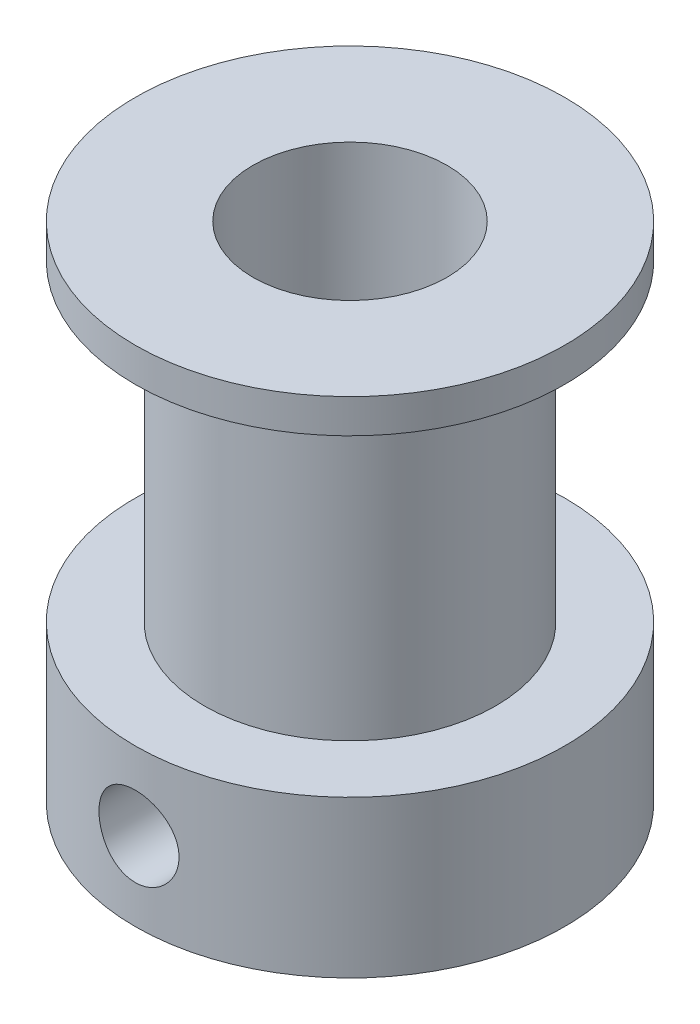
from build123d import *

# Parameters (mm, degrees)
CROQUIS1_R              = 8.85
SALIENTE_EXTRUIR1_DEPTH = 6.45
CROQUIS2_R              = 6
SALIENTE_EXTRUIR2_DEPTH = 12.9
CROQUIS3_R              = 8.85
SALIENTE_EXTRUIR3_DEPTH = 1.4
CROQUIS4_R              = 4
CORTAR_EXTRUIR1_DEPTH   = 25.232364722
CROQUIS6_W              = 1.65
CROQUIS6_H              = 8.851
MATRIZC1_COUNT          = 2
MATRIZC1_ANGLE          = 90


with BuildPart() as part:
    # Croquis1 → Saliente-Extruir1 (new body)
    with BuildSketch(Plane(origin=(0, 0, 0), x_dir=(1, 0, 0), z_dir=(0, 1, 0))):
        with Locations(Location((0, 0, 0), (0, 0, 90))):
            Circle(CROQUIS1_R)
    extrude(amount=SALIENTE_EXTRUIR1_DEPTH)

    # Croquis2 → Saliente-Extruir2 (add)
    with BuildSketch(Plane(origin=(0, 6.45, 0), x_dir=(1, 0, 0), z_dir=(0, 1, 0))):
        with Locations(Location((0, 0, 0), (0, 0, 90))):
            Circle(CROQUIS2_R)
    extrude(amount=SALIENTE_EXTRUIR2_DEPTH)

    # Croquis3 → Saliente-Extruir3 (add)
    with BuildSketch(Plane(origin=(0, 19.35, 0), x_dir=(1, 0, 0), z_dir=(0, 1, 0))):
        with Locations(Location((0, 0, 0), (0, 0, 90))):
            Circle(CROQUIS3_R)
    extrude(amount=SALIENTE_EXTRUIR3_DEPTH)

    # Croquis4 → Cortar-Extruir1 (cut, through all)
    with BuildSketch(Plane(origin=(0, 20.75, 0), x_dir=(1, 0, 0), z_dir=(0, 1, 0))):
        with Locations(Location((0, 0, 0), (0, 0, 270))):
            Circle(CROQUIS4_R)
    extrude(amount=-CORTAR_EXTRUIR1_DEPTH, mode=Mode.SUBTRACT)

    # Croquis6 → Taladro roscado M41 (falta definir posicio) (revolve, cut)
    with BuildSketch(Plane(origin=(0, 3.225, 0), x_dir=(0, 1, 0), z_dir=(1, 0, 0))):
        with Locations((0.825, 4.4255)):
            Rectangle(CROQUIS6_W, CROQUIS6_H)
    taladro_roscado_m41_falta_definir_posic = revolve(axis=Axis((0, 3.225, -6.35), (0, 0, 1)), mode=Mode.SUBTRACT)

    # MatrizC1: Taladro roscado M41 (falta definir posicio) ×2 about axis
    matrizc1_axis = Axis((0, 6.45, 0), (0, -1, 0))
    for i in range(1, MATRIZC1_COUNT):
        add(taladro_roscado_m41_falta_definir_posic.rotate(matrizc1_axis, i * MATRIZC1_ANGLE / (MATRIZC1_COUNT - 1)), mode=Mode.SUBTRACT)


solid = part.part
